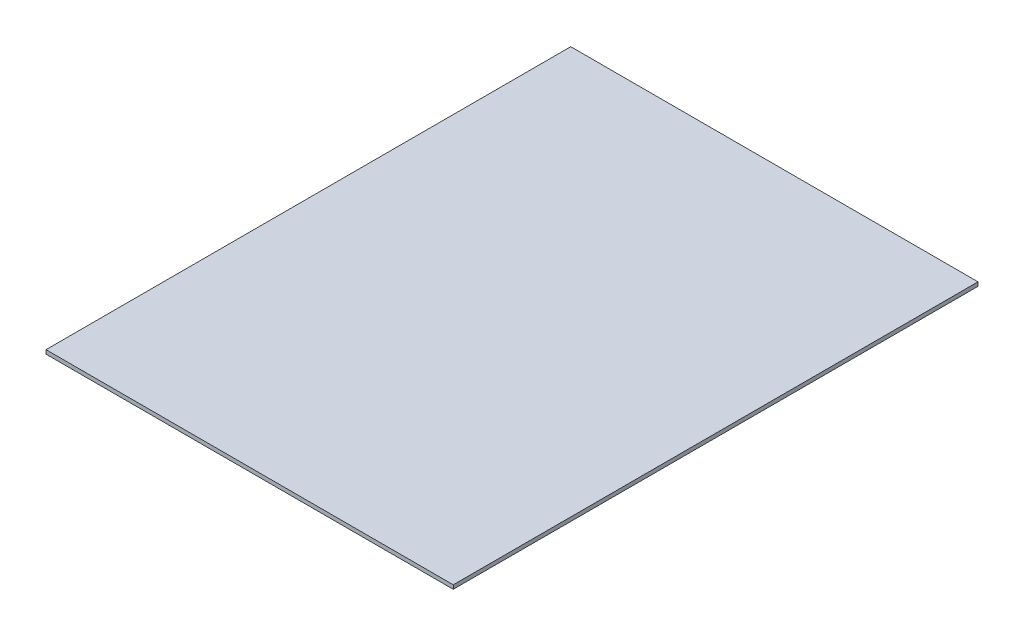
from build123d import *

# Parameters (mm, degrees)
SKETCH_1_W      = 520
SKETCH_1_H      = 670
EXTRUDE_1_DEPTH = 5


with BuildPart() as part:
    # 草图1 → 凸台-拉伸1 (new body)
    with BuildSketch(Plane(origin=(0, 0, 0), x_dir=(1, 0, 0), z_dir=(0, 1, 0))):
        Rectangle(SKETCH_1_W, SKETCH_1_H)
    extrude(amount=EXTRUDE_1_DEPTH)


solid = part.part
